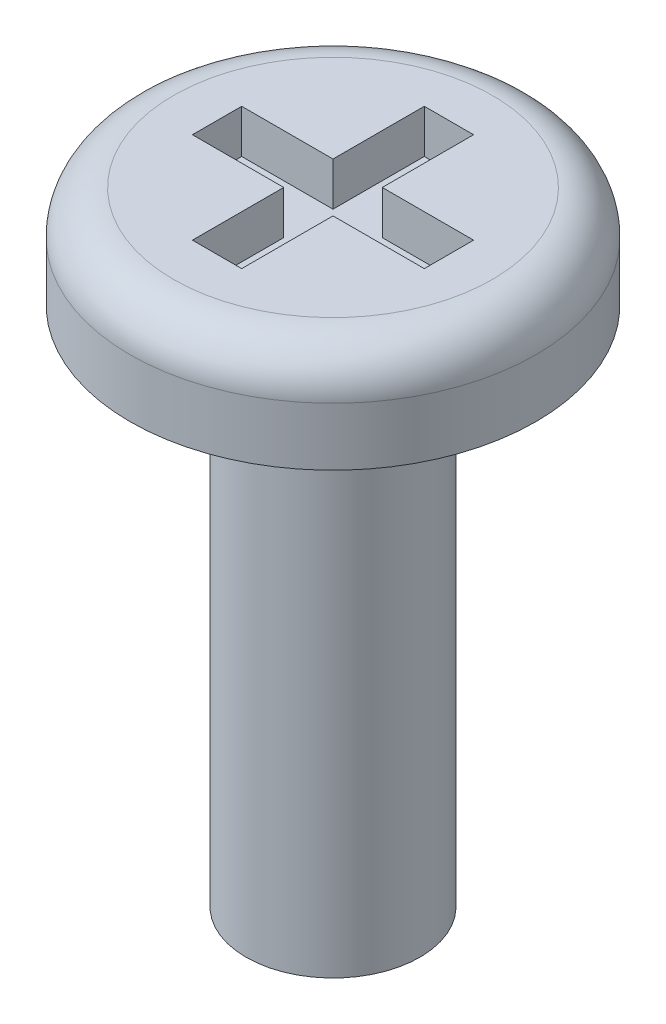
from build123d import *

# Parameters (mm, degrees)
SKETCH3_R           = 1.5
BOSS_EXTRUDE1_DEPTH = 9
SKETCH4_R           = 3.5
BOSS_EXTRUDE2_DEPTH = 1.75
FILLET3_R           = 0.75
CUT_EXTRUDE4_DEPTH  = 0.75
FILLET4_R           = 0.25


with BuildPart() as part:
    # Sketch3 → Boss-Extrude1 (new body)
    with BuildSketch(Plane(origin=(0, 0, 0), x_dir=(1, 0, 0), z_dir=(0, 1, 0))):
        with Locations(Location((0, 0, 0), (0, 0, 270))):
            Circle(SKETCH3_R)
    extrude(amount=BOSS_EXTRUDE1_DEPTH)

    # Sketch4 → Boss-Extrude2 (add)
    with BuildSketch(Plane(origin=(0, 9, 0), x_dir=(1, 0, 0), z_dir=(0, 1, 0))):
        with Locations(Location((0, 0, 0), (0, 0, 270))):
            Circle(SKETCH4_R)
    extrude(amount=BOSS_EXTRUDE2_DEPTH)

    # Fillet3
    fillet3_edges = [part.edges().sort_by_distance(p)[0] for p in [
        (0, 10.75, -3.5),
    ]]
    fillet(fillet3_edges, radius=FILLET3_R)

    # Sketch6 → Cut-Extrude4 (cut)
    with BuildSketch(Plane(origin=(0, 10.75, 0), x_dir=(1, 0, 0), z_dir=(0, 1, 0))):
        Polygon((0.425, 0.425), (2, 0.425), (2, -0.425), (0.425, -0.425), (0.425, -2), (-0.425, -2), (-0.425, -0.425), (-2, -0.425), (-2, 0.425), (-0.425, 0.425), (-0.425, 2), (0.425, 2), align=None)
    extrude(amount=-CUT_EXTRUDE4_DEPTH, mode=Mode.SUBTRACT)

    # Fillet4
    fillet4_edges = [part.edges().sort_by_distance(p)[0] for p in [
        (0, 9, -1.5),
    ]]
    fillet(fillet4_edges, radius=FILLET4_R)


solid = part.part
